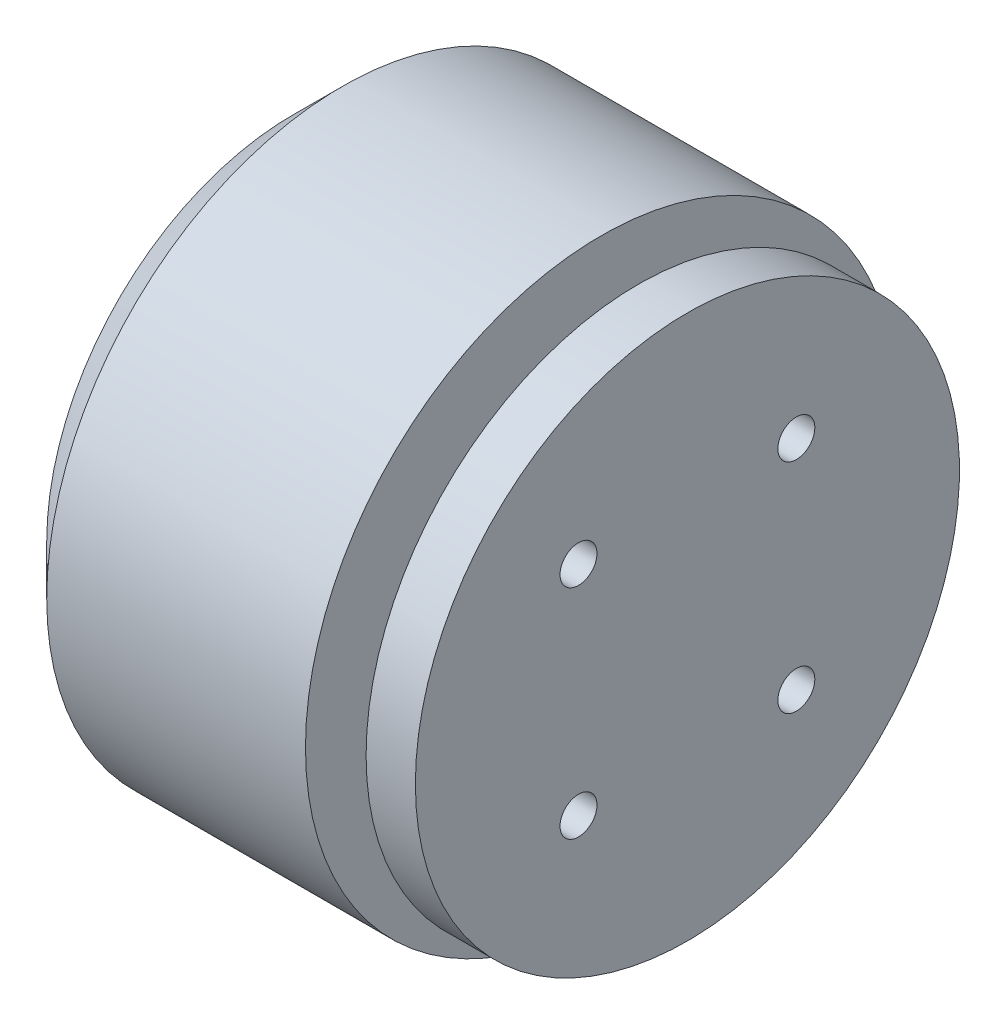
from build123d import *

# Parameters (mm, degrees)
SKETCH2_R          = 1.5
CUT_EXTRUDE1_DEPTH = 3.3
SKETCH3_R          = 1.5
CUT_EXTRUDE2_DEPTH = 8


with BuildPart() as part:
    # Sketch1 → Revolve1 (revolve)
    with BuildSketch(Plane.XY, mode=Mode.PRIVATE) as revolve1_sk:
        Polygon((0, 0), (0, 22.08), (-4, 22.08), (-4, 16.8), (-7, 16.8), (-7, 24), (-28, 24), (-32, 20), (-32, 2), (-44, 2), (-44, 0), align=None)
    revolve(revolve1_sk.sketch.rotate(Axis((-10, 0, 0), (1, 0, 0)), 90), axis=Axis((-10, 0, 0), (1, 0, 0)))

    # Sketch2 → Cut-Extrude1 (cut)
    with BuildSketch(Plane(origin=(0, 0, 0), x_dir=(0, 0, -1), z_dir=(1, 0, 0))):
        with Locations((-8.84, 8.84)):
            Circle(SKETCH2_R)
        with Locations((-8.84, -8.84)):
            Circle(SKETCH2_R)
        with Locations((8.84, 8.84)):
            Circle(SKETCH2_R)
        with Locations((8.84, -8.84)):
            Circle(SKETCH2_R)
    extrude(amount=-CUT_EXTRUDE1_DEPTH, mode=Mode.SUBTRACT)

    # Sketch3 → Cut-Extrude2 (cut)
    with BuildSketch(Plane(origin=(-32, 0, 0), x_dir=(0, 0, -1), z_dir=(1, 0, 0))):
        with Locations((-6, 0)):
            Circle(SKETCH3_R)
        with Locations((6, 0)):
            Circle(SKETCH3_R)
        with Locations((0, 6)):
            Circle(SKETCH3_R)
        with Locations((0, -6)):
            Circle(SKETCH3_R)
    extrude(amount=CUT_EXTRUDE2_DEPTH, mode=Mode.SUBTRACT)


solid = part.part
